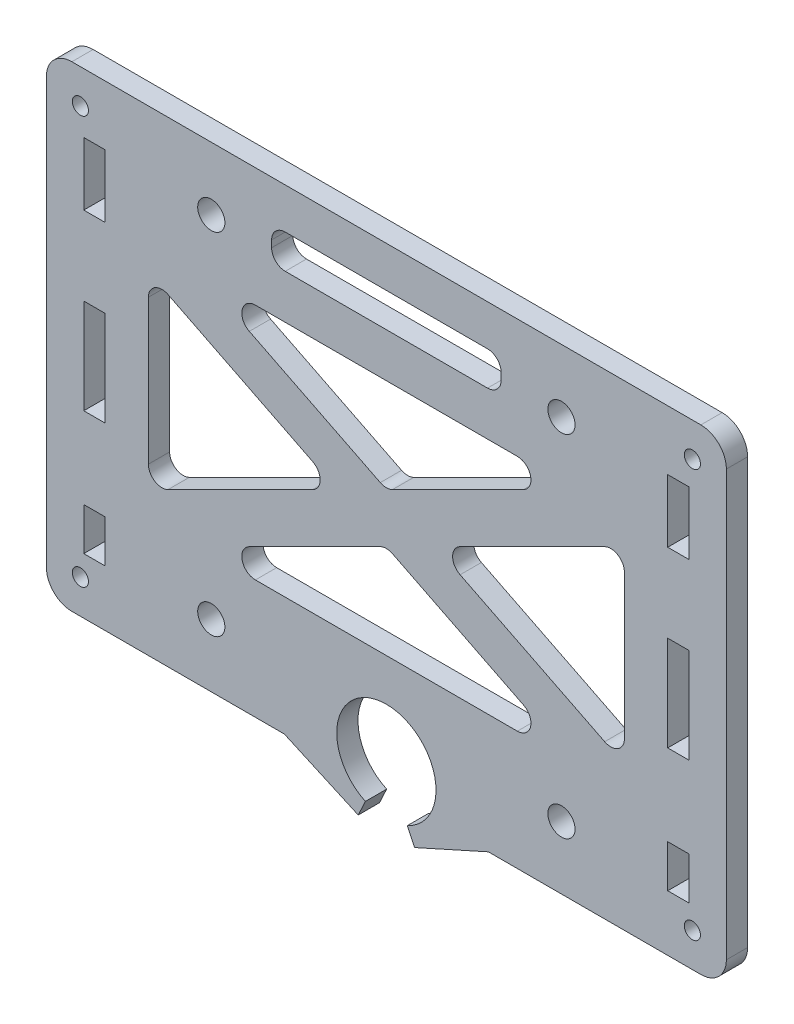
from build123d import *

# Parameters (mm, degrees)
SKETCH1_R           = 0.60325
SKETCH1_W           = 1.5875
SKETCH1_H           = 3.175
SKETCH1_R_2         = 1.016
SKETCH1_H_2         = 7.0993
SKETCH1_H_3         = 4.699
BOSS_EXTRUDE1_DEPTH = 1.5875
SPEED_HOLES_REACH   = 34.529
SKETCH2_W           = 17.145
SKETCH2_H           = 2.54
FILLET1_R           = 1.016


with BuildPart() as part:
    # Sketch1 → Boss-Extrude1 (new body)
    with BuildSketch(Plane.XY):
        with BuildLine():
            ThreePointArc((25.4, 15.875), (24.842038418, 17.222038418), (23.495, 17.78))
            Line((23.495, 17.78), (-23.495, 17.78))
            ThreePointArc((-23.495, 17.78), (-24.842038418, 17.222038418), (-25.4, 15.875))
            Line((-25.4, 15.875), (-25.4, -15.875))
            ThreePointArc((-25.4, -15.875), (-24.842038418, -17.222038418), (-23.495, -17.78))
            Line((-23.495, -17.78), (-7.62, -17.78))
            Line((-7.62, -17.78), (-2.103962754, -20.259962687))
            Line((-2.103962754, -20.259962687), (-1.567237562, -19.108951797))
            ThreePointArc((-1.567237562, -19.108951797), (0, -12.0396), (1.567237562, -19.108951797))
            Line((1.567237562, -19.108951797), (2.103962754, -20.259962687))
            Line((2.103962754, -20.259962687), (7.62, -17.78))
            Line((7.62, -17.78), (23.495, -17.78))
            ThreePointArc((23.495, -17.78), (24.842038418, -17.222038418), (25.4, -15.875))
            Line((25.4, -15.875), (25.4, 15.875))
        make_face()
        with Locations((-22.86, -15.24)):
            Circle(SKETCH1_R, mode=Mode.SUBTRACT)
        with Locations((-21.81225, -12.011129894)):
            Rectangle(SKETCH1_W, SKETCH1_H, mode=Mode.SUBTRACT)
        with Locations((-13.08, -13.08)):
            Circle(SKETCH1_R_2, mode=Mode.SUBTRACT)
        with Locations((13.08, -13.08)):
            Circle(SKETCH1_R_2, mode=Mode.SUBTRACT)
        with Locations((22.86, -15.24)):
            Circle(SKETCH1_R, mode=Mode.SUBTRACT)
        with Locations((21.81225, -12.011129894)):
            Rectangle(SKETCH1_W, SKETCH1_H, mode=Mode.SUBTRACT)
        with Locations((-21.81225, -0.80645)):
            Rectangle(SKETCH1_W, SKETCH1_H_2, mode=Mode.SUBTRACT)
        with Locations((-21.81225, 10.975870106)):
            Rectangle(SKETCH1_W, SKETCH1_H_3, mode=Mode.SUBTRACT)
        with Locations((-22.86, 15.24)):
            Circle(SKETCH1_R, mode=Mode.SUBTRACT)
        with Locations((-13.08, 13.08)):
            Circle(SKETCH1_R_2, mode=Mode.SUBTRACT)
        with Locations((21.81225, -0.80645)):
            Rectangle(SKETCH1_W, SKETCH1_H_2, mode=Mode.SUBTRACT)
        with Locations((21.81225, 10.975870106)):
            Rectangle(SKETCH1_W, SKETCH1_H_3, mode=Mode.SUBTRACT)
        with Locations((13.08, 13.08)):
            Circle(SKETCH1_R_2, mode=Mode.SUBTRACT)
        with Locations((22.86, 15.24)):
            Circle(SKETCH1_R, mode=Mode.SUBTRACT)
    extrude(amount=BOSS_EXTRUDE1_DEPTH)

    # Sketch2 → Speed Holes (cut, up to next)
    with BuildSketch(Plane.XY.offset(1.5875), mode=Mode.PRIVATE) as speed_holes_sk1:
        Polygon((3.691748231, 0), (17.78, -7.044125885), (17.78, 7.044125885), align=None)
    speed_holes_tool1 = extrude(speed_holes_sk1.sketch, amount=-SPEED_HOLES_REACH, mode=Mode.PRIVATE) & part.part
    # Sketch2 → Speed Holes (cut, up to next)
    with BuildSketch(Plane.XY.offset(1.5875), mode=Mode.PRIVATE) as speed_holes_sk2:
        Polygon((-14.088251769, 8.89), (0, 1.845874115), (14.088251769, 8.89), align=None)
    speed_holes_tool2 = extrude(speed_holes_sk2.sketch, amount=-SPEED_HOLES_REACH, mode=Mode.PRIVATE) & part.part
    # Sketch2 → Speed Holes (cut, up to next)
    with BuildSketch(Plane.XY.offset(1.5875), mode=Mode.PRIVATE) as speed_holes_sk3:
        Polygon((14.088251769, -8.89), (0, -1.845874115), (-14.088251769, -8.89), align=None)
    speed_holes_tool3 = extrude(speed_holes_sk3.sketch, amount=-SPEED_HOLES_REACH, mode=Mode.PRIVATE) & part.part
    # Sketch2 → Speed Holes (cut, up to next)
    with BuildSketch(Plane.XY.offset(1.5875), mode=Mode.PRIVATE) as speed_holes_sk4:
        Polygon((-17.78, -7.044125885), (-3.691748231, 0), (-17.78, 7.044125885), align=None)
    speed_holes_tool4 = extrude(speed_holes_sk4.sketch, amount=-SPEED_HOLES_REACH, mode=Mode.PRIVATE) & part.part
    # Sketch2 → Speed Holes (cut, up to next)
    with BuildSketch(Plane.XY.offset(1.5875), mode=Mode.PRIVATE) as speed_holes_sk5:
        with Locations((0, 13.462)):
            Rectangle(SKETCH2_W, SKETCH2_H)
    speed_holes_tool5 = extrude(speed_holes_sk5.sketch, amount=-SPEED_HOLES_REACH, mode=Mode.PRIVATE) & part.part
    add(speed_holes_tool1.solids().sort_by_distance((13.083916, 0, 1.5875))[0], mode=Mode.SUBTRACT)
    add(speed_holes_tool2.solids().sort_by_distance((0, 6.541958, 1.5875))[0], mode=Mode.SUBTRACT)
    add(speed_holes_tool3.solids().sort_by_distance((0, -6.541958, 1.5875))[0], mode=Mode.SUBTRACT)
    add(speed_holes_tool4.solids().sort_by_distance((-13.083916, 0, 1.5875))[0], mode=Mode.SUBTRACT)
    add(speed_holes_tool5.solids().sort_by_distance((0, 13.462, 1.5875))[0], mode=Mode.SUBTRACT)

    # Fillet1
    fillet1_edges = [part.edges().sort_by_distance(p)[0] for p in [
        (-14.088251769, -8.89, 0.79375),
        (-17.78, -7.044125885, 0.79375),
        (0, 1.845874115, 0.79375),
        (14.088251769, -8.89, 0.79375),
        (17.78, -7.044125885, 0.79375),
        (17.78, 7.044125885, 0.79375),
        (-3.691748231, 0, 0.79375),
        (14.088251769, 8.89, 0.79375),
        (3.691748231, 0, 0.79375),
        (-14.088251769, 8.89, 0.79375),
        (0, -1.845874115, 0.79375),
        (-17.78, 7.044125885, 0.79375),
        (-8.5725, 14.732, 0.79375),
        (-8.5725, 12.192, 0.79375),
        (8.5725, 14.732, 0.79375),
        (8.5725, 12.192, 0.79375),
    ]]
    fillet(fillet1_edges, radius=FILLET1_R)


solid = part.part
